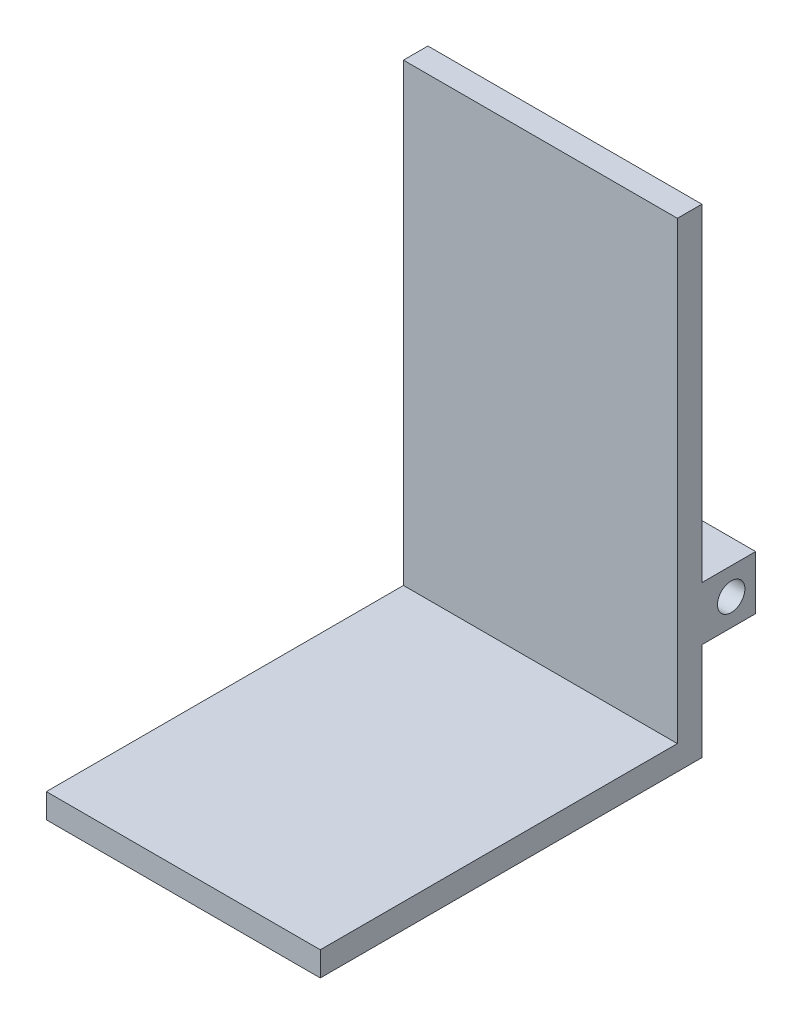
from build123d import *

# Parameters (mm, degrees)
SKETCH1_W           = 28
SKETCH1_H           = 39
BOSS_EXTRUDE1_DEPTH = 2.5
SKETCH2_W           = 28
SKETCH2_H           = 2.5
BOSS_EXTRUDE2_DEPTH = 46.5
SKETCH3_W           = 5.5
SKETCH3_H           = 5.5
SKETCH3_R           = 1.4
BOSS_EXTRUDE3_DEPTH = 28


with BuildPart() as part:
    # Sketch1 → Boss-Extrude1 (new body)
    with BuildSketch(Plane(origin=(0, 0, 0), x_dir=(1, 0, 0), z_dir=(0, 1, 0))):
        Rectangle(SKETCH1_W, SKETCH1_H)
    extrude(amount=BOSS_EXTRUDE1_DEPTH)

    # Sketch2 → Boss-Extrude2 (add)
    with BuildSketch(Plane(origin=(0, 2.5, 0), x_dir=(1, 0, 0), z_dir=(0, 1, 0))):
        with Locations((0, 18.25)):
            Rectangle(SKETCH2_W, SKETCH2_H)
    extrude(amount=BOSS_EXTRUDE2_DEPTH)

    # Sketch3 → Boss-Extrude3 (add)
    with BuildSketch(Plane(origin=(14, 0, 0), x_dir=(0, 0, -1), z_dir=(1, 0, 0))):
        with Locations((22.25, 12.75)):
            Rectangle(SKETCH3_W, SKETCH3_H)
        with Locations((22.5, 12.75)):
            Circle(SKETCH3_R, mode=Mode.SUBTRACT)
    extrude(amount=-BOSS_EXTRUDE3_DEPTH)


solid = part.part
